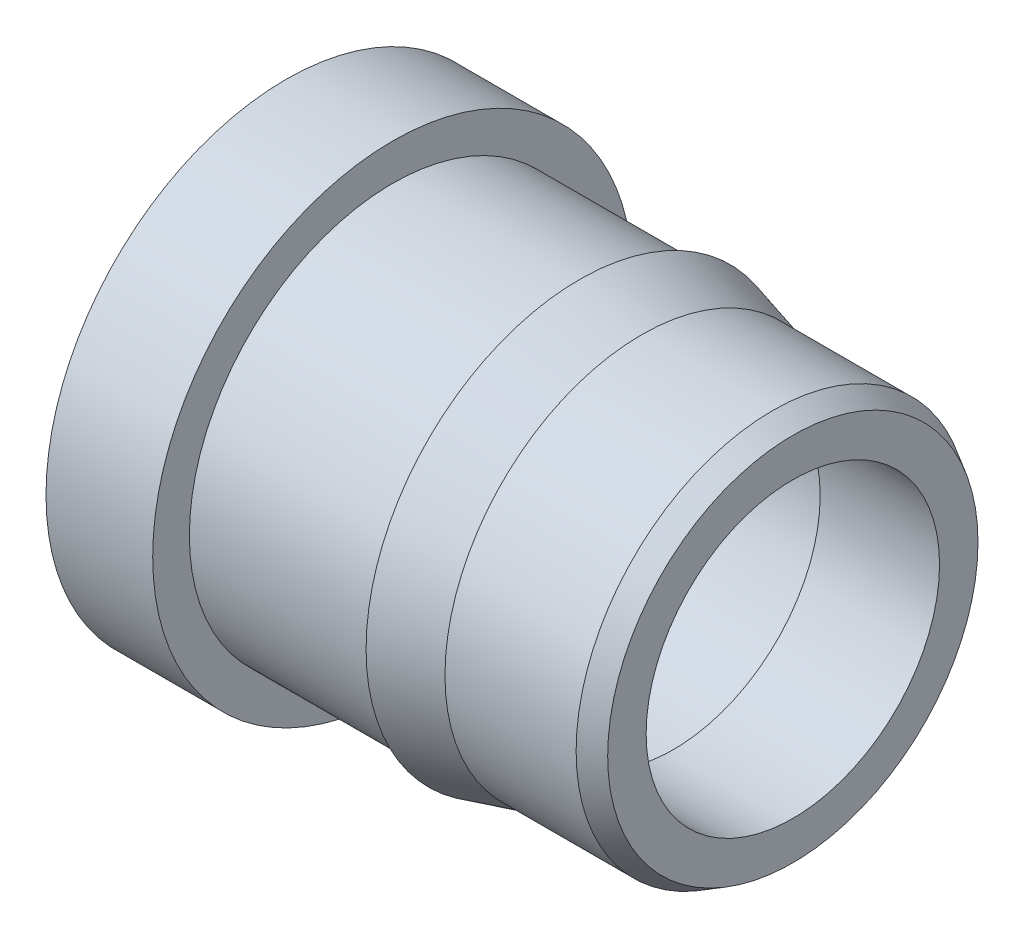
from build123d import *

# Parameters (mm, degrees)
HOLE1_D     = 1.2954
HOLE1_DEPTH = 1.4224
HOLE1_TIP   = 0.389177423
HOLE2_D     = 1.1176
HOLE2_DEPTH = 1.9304
HOLE2_TIP   = 0.335760914


with BuildPart() as part:
    # Sketch1 → RevolutionAngle1 (revolve)
    with BuildSketch(Plane.XY, mode=Mode.PRIVATE) as revolutionangle1_sk:
        Polygon((0, 0), (0, 0.9144), (0.4064, 0.9144), (0.4064, 0.7747), (1.1176, 0.7747), (1.1176, 0.8128), (1.354585226, 0.7493), (1.8542, 0.7493), (1.9304, 0.705305909), (1.9304, 0), align=None)
    revolve(revolutionangle1_sk.sketch.rotate(Axis((0, 0, 0), (1, 0, 0)), 90), axis=Axis((0, 0, 0), (1, 0, 0)))

    # Hole1
    with Locations(Plane.ZY):
        with Locations((0, 0)):
            Hole(HOLE1_D / 2, depth=HOLE1_DEPTH)
            with Locations((0, 0, -(HOLE1_DEPTH + HOLE1_TIP / 2))):  # 118° drill point
                Cone(0, HOLE1_D / 2, HOLE1_TIP, mode=Mode.SUBTRACT)

    # Hole2
    with Locations(Plane(origin=(1.9304, 0, 0), x_dir=(0, 0, 1), z_dir=(1, 0, 0))):
        with Locations((0, 0)):
            Hole(HOLE2_D / 2, depth=HOLE2_DEPTH)
            with Locations((0, 0, -(HOLE2_DEPTH + HOLE2_TIP / 2))):  # 118° drill point
                Cone(0, HOLE2_D / 2, HOLE2_TIP, mode=Mode.SUBTRACT)


solid = part.part
